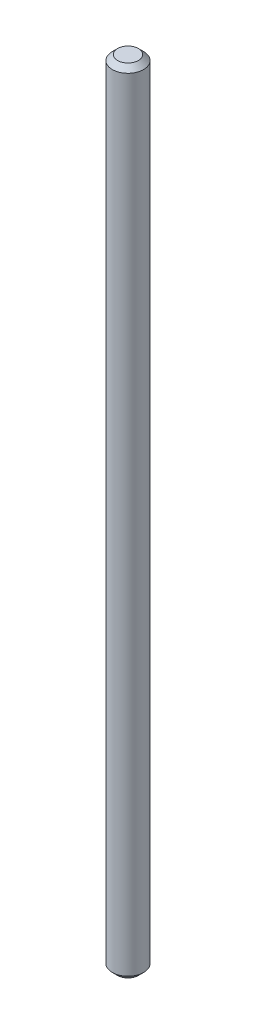
from build123d import *

# Parameters (mm, degrees)
SKETCH2_R           = 1.5
BOSS_EXTRUDE1_DEPTH = 76
CHAMFER1_SIZE       = 0.5


with BuildPart() as part:
    # Sketch2 → Boss-Extrude1 (new body)
    with BuildSketch(Plane(origin=(0, 0, 0), x_dir=(1, 0, 0), z_dir=(0, 1, 0))):
        with Locations(Location((0, 0, 0), (0, 0, 270))):
            Circle(SKETCH2_R)
    extrude(amount=BOSS_EXTRUDE1_DEPTH)

    # Chamfer1
    chamfer1_edges = [part.edges().sort_by_distance(p)[0] for p in [
        (0, 0, -1.5),
        (0, 76, -1.5),
    ]]
    chamfer(chamfer1_edges, length=CHAMFER1_SIZE)


solid = part.part
